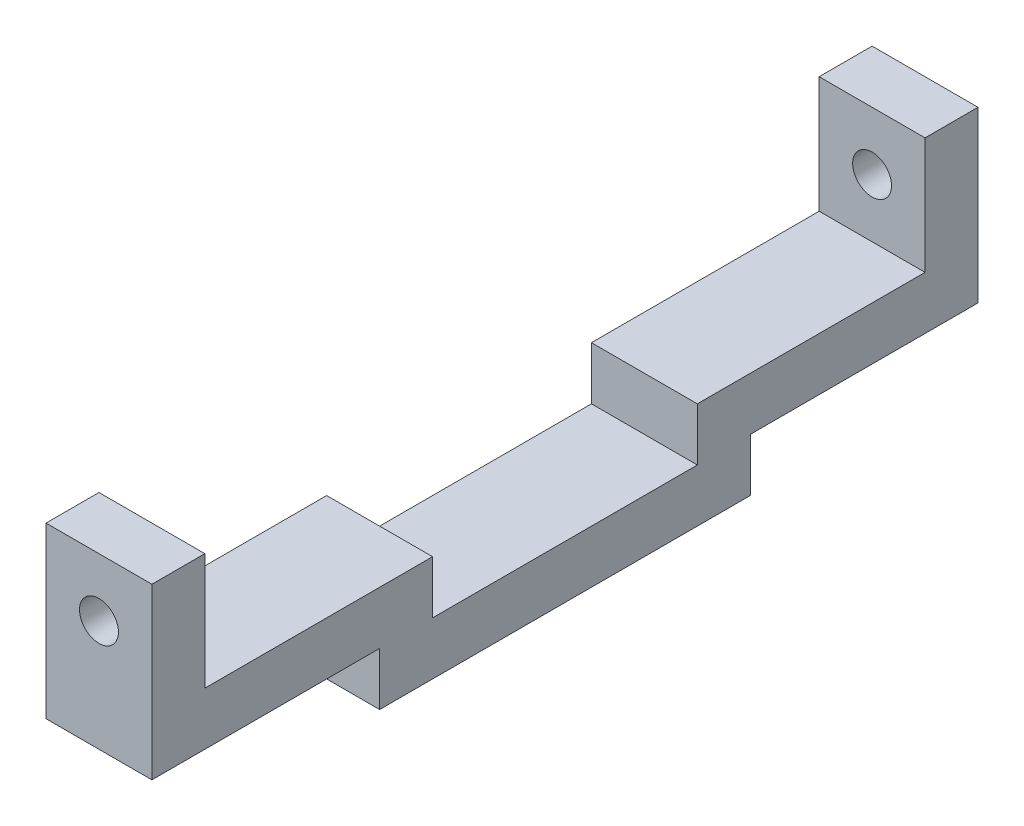
from build123d import *

# Parameters (mm, degrees)
SKETCH1_W               = 21.5
SKETCH1_H               = 5
BOSS_EXTRUDE1_DEPTH     = 10
CUT_EXTRUDE1_DEPTH      = 75.426137882
CUT_EXTRUDE1_DEPTH_BACK = 75.426137882
SKETCH2_R               = 1.836585915
SKETCH3_W               = 21.5
SKETCH3_H               = 5
CUT_EXTRUDE2_DEPTH      = 10


with BuildPart() as part:
    # Sketch1 → Boss-Extrude1 (new body)
    with BuildSketch(Plane(origin=(0, 0, 0), x_dir=(0, 0, -1), z_dir=(1, 0, 0))):
        Polygon((-39, 10.5), (-39, -10.5), (39, -10.5), (39, 10.5), (34, 10.5), (34, -0.5), (34, -5.5), (12.5, -5.5), (-12.5, -5.5), (-34, -5.5), (-34, -0.5), (-34, 10.5), align=None)
        with Locations((-23.25, -3)):
            Rectangle(SKETCH1_W, SKETCH1_H)
        with Locations((23.25, -3)):
            Rectangle(SKETCH1_W, SKETCH1_H)
    extrude(amount=BOSS_EXTRUDE1_DEPTH)

    # Sketch2 → Cut-Extrude1 (cut, two sides: drawn at the far end of the back side and taken through both)
    with BuildSketch(Plane.XY.offset(-34).offset(-CUT_EXTRUDE1_DEPTH_BACK)):
        with Locations((5, 5)):
            Circle(SKETCH2_R)
    extrude(amount=CUT_EXTRUDE1_DEPTH + CUT_EXTRUDE1_DEPTH_BACK, mode=Mode.SUBTRACT)

    # Sketch3 → Cut-Extrude2 (cut)
    with BuildSketch(Plane(origin=(10, 0, 0), x_dir=(0, 0, -1), z_dir=(1, 0, 0))):
        with Locations((-28.25, -8)):
            Rectangle(SKETCH3_W, SKETCH3_H)
    cut_extrude2 = extrude(amount=-CUT_EXTRUDE2_DEPTH, mode=Mode.SUBTRACT)

    # Mirror1: Cut-Extrude2 across plane
    add(cut_extrude2.mirror(Plane.XY), mode=Mode.SUBTRACT)


solid = part.part
